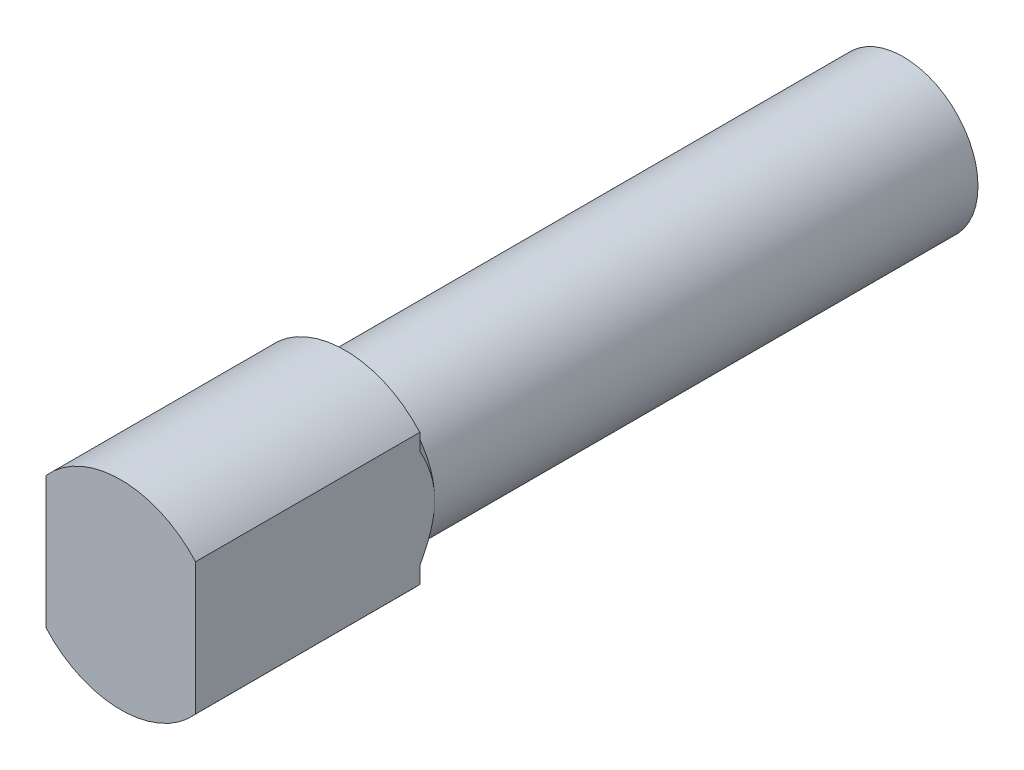
from build123d import *

# Parameters (mm, degrees)
SKETCH_1_R          = 15
EXTRUDE_1_DEPTH     = 112
SKETCH_2_R          = 20
EXTRUDE_2_DEPTH     = 45
CHAMFER_1_SIZE      = 3
SKETCH_3_W          = 15.452934815
SKETCH_3_H          = 42.066322552
CUT_EXTRUDE_3_DEPTH = 160.527427109


with BuildPart() as part:
    # Эскиз1 → Вытянуть1 (new body)
    with BuildSketch(Plane.XY):
        Circle(SKETCH_1_R)
    extrude(amount=EXTRUDE_1_DEPTH)

    # Эскиз2 → Вытянуть2 (add)
    with BuildSketch(Plane.XY.offset(112)):
        with Locations(Location((0, 0, 0), (0, 0, 180))):
            Circle(SKETCH_2_R)
    extrude(amount=EXTRUDE_2_DEPTH)

    # Фаска1
    chamfer_1_edges = [part.edges().sort_by_distance(p)[0] for p in [
        (-15, 0, 112),
    ]]
    chamfer(chamfer_1_edges, length=CHAMFER_1_SIZE)

    # Эскиз3 → Вытянуть3 (cut, through all)
    with BuildSketch(Plane.XY.offset(157)):
        with Locations((22.726467408, -0.268280118)):
            Rectangle(SKETCH_3_W, SKETCH_3_H)
        with Locations((-22.726467408, -0.268280118)):
            Rectangle(SKETCH_3_W, SKETCH_3_H)
    extrude(amount=-CUT_EXTRUDE_3_DEPTH, mode=Mode.SUBTRACT)


solid = part.part
